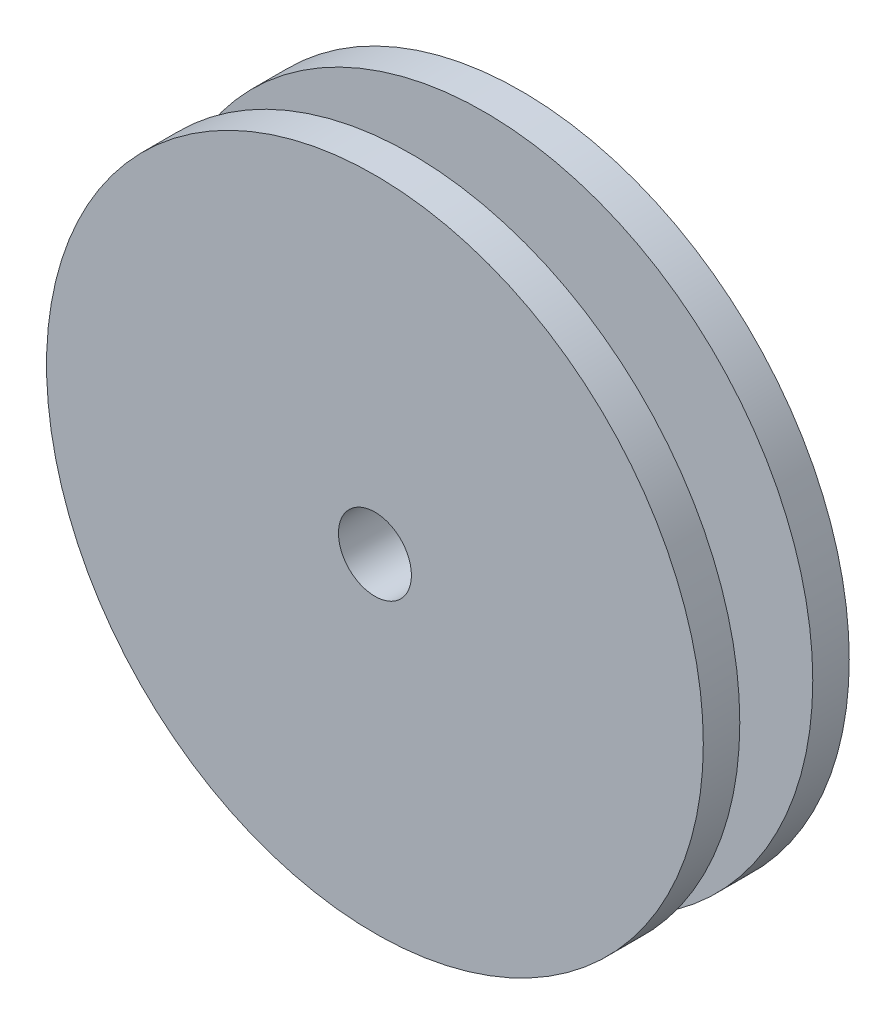
from build123d import *

# Parameters (mm, degrees)
SKETCH_1_R          = 13.5
EXTRUDE_1_DEPTH     = 6
SKETCH_3_R          = 1.5
CUT_EXTRUDE_2_DEPTH = 21.012496096
CUT_EXTRUDE_START   = -3
SKETCH_4_R          = 13.5
SKETCH_4_R_2        = 9
CUT_EXTRUDE_3_DEPTH = 3


with BuildPart() as part:
    # 草图1 → 凸台-拉伸1 (new body)
    with BuildSketch(Plane.XY):
        Circle(SKETCH_1_R)
    extrude(amount=EXTRUDE_1_DEPTH)

    # 草图3 → 切除-拉伸2 (cut, through all)
    with BuildSketch(Plane.XY):
        Circle(SKETCH_3_R)
    extrude(amount=CUT_EXTRUDE_2_DEPTH, mode=Mode.SUBTRACT)

    # 草图4 → 切除-拉伸3 (cut)
    with BuildSketch(Plane.XY.offset(4.5).offset(CUT_EXTRUDE_START)):
        Circle(SKETCH_4_R)
        Circle(SKETCH_4_R_2, mode=Mode.SUBTRACT)
    extrude(amount=CUT_EXTRUDE_3_DEPTH, mode=Mode.SUBTRACT)


solid = part.part
